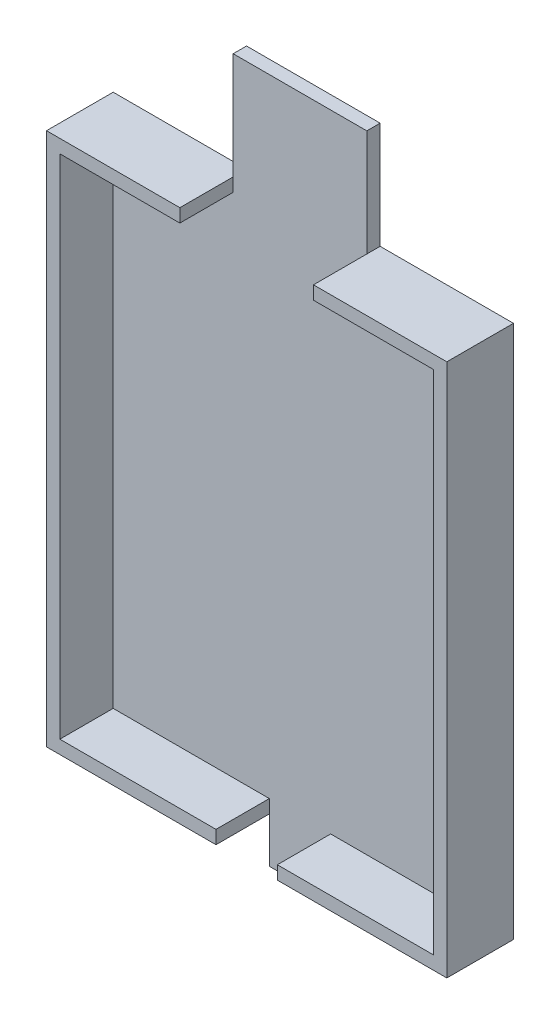
from build123d import *

# Parameters (mm, degrees)
BOSS_EXTRUDE1_DEPTH = 5
BOSS_EXTRUDE4_DEPTH = 20
BOSS_EXTRUDE5_DEPTH = 20


with BuildPart() as part:
    # Sketch1 → Boss-Extrude1 (new body)
    with BuildSketch(Plane(origin=(0, 0, 0), x_dir=(0, 1, 0), z_dir=(0, 0, 1))):
        Polygon((-65.650485437, 9.713592233), (-65.650485437, -13.286407767), (-48.650485437, -13.286407767), (-48.650485437, -76.836407767), (151.449514563, -76.836407767), (151.449514563, -26.836407767), (191.449514563, -26.836407767), (191.449514563, 23.263592233), (151.449514563, 23.263592233), (151.449514563, 73.263592233), (-48.650485437, 73.263592233), (-48.650485437, 9.713592233), align=None)
    extrude(amount=BOSS_EXTRUDE1_DEPTH)

    # Sketch7 → Boss-Extrude4 (add)
    with BuildSketch(Plane.XY.offset(5)):
        Polygon((-23.263592233, 151.449514563), (-73.263592233, 151.449514563), (-73.263592233, -48.650485437), (-9.713592233, -48.650485437), (-9.713592233, -43.650485437), (-68.263592233, -43.650485437), (-68.263592233, 146.449514563), (-23.263592233, 146.449514563), align=None)
    extrude(amount=BOSS_EXTRUDE4_DEPTH)

    # Sketch9 → Boss-Extrude5 (add)
    with BuildSketch(Plane.XY.offset(5)):
        Polygon((26.836407767, 151.449514563), (76.836407767, 151.449514563), (76.836407767, -48.650485437), (13.286407767, -48.650485437), (13.286407767, -43.650485437), (71.836407767, -43.650485437), (71.836407767, 146.449514563), (26.836407767, 146.449514563), align=None)
    extrude(amount=BOSS_EXTRUDE5_DEPTH)


solid = part.part
